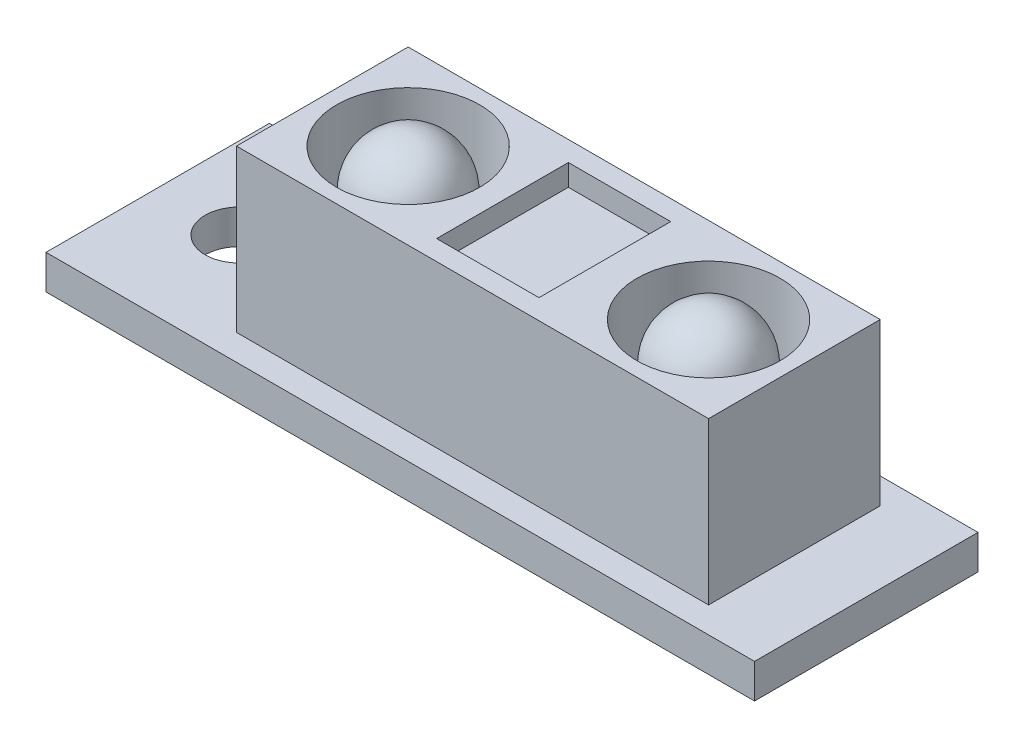
from build123d import *

# Parameters (mm, degrees)
SKETCH1_W                  = 33.02
SKETCH1_H                  = 10.414
BOSS_EXTRUDE1_DEPTH        = 1.6
SKETCH2_R                  = 1.6
CUT_EXTRUDE1_DEPTH         = 18.385423463
SKETCH3_W                  = 22
SKETCH3_H                  = 8
BOSS_EXTRUDE2_DEPTH        = 7.52
SKETCH5_R                  = 3.335
CUT_EXTRUDE2_DEPTH         = 5
SKETCH6_R                  = 2.334999968
BOSS_EXTRUDE3_DEPTH        = 3
DOME1_FACE_RADIUS          = 2.334999968
DOME1_HEIGHT               = 2.54
MIRROR1_COPY_1_FACE_RADIUS = 2.334999968
MIRROR1_COPY_1_HEIGHT      = 2.54
SKETCH7_W                  = 4.77
SKETCH7_H                  = 6.139999912
CUT_EXTRUDE3_DEPTH         = 1


with BuildPart() as part:
    # Sketch1 → Boss-Extrude1 (new body)
    with BuildSketch(Plane(origin=(0, 0, 0), x_dir=(1, 0, 0), z_dir=(0, 1, 0))):
        Rectangle(SKETCH1_W, SKETCH1_H)
    extrude(amount=BOSS_EXTRUDE1_DEPTH)

    # Sketch2 → Cut-Extrude1 (cut, through all)
    with BuildSketch(Plane(origin=(0, 1.6, 0), x_dir=(1, 0, 0), z_dir=(0, 1, 0))):
        with Locations(Location((-12.7, 0, 0), (0, 0, 270))):
            Circle(SKETCH2_R)
    extrude(amount=-CUT_EXTRUDE1_DEPTH, mode=Mode.SUBTRACT)

    # Sketch3 → Boss-Extrude2 (add)
    with BuildSketch(Plane(origin=(0, 1.6, 0), x_dir=(1, 0, 0), z_dir=(0, 1, 0))):
        with Locations((2.16, 0)):
            Rectangle(SKETCH3_W, SKETCH3_H)
    extrude(amount=BOSS_EXTRUDE2_DEPTH)

    # Sketch5 → Cut-Extrude2 (cut)
    with BuildSketch(Plane(origin=(0, 9.12, 0), x_dir=(1, 0, 0), z_dir=(0, 1, 0))):
        with Locations(Location((-4.84, 0, 0), (0, 0, 270))):
            Circle(SKETCH5_R)
        with Locations(Location((9.16, 0, 0), (0, 0, 90))):
            Circle(SKETCH5_R)
    extrude(amount=-CUT_EXTRUDE2_DEPTH, mode=Mode.SUBTRACT)

    # Sketch6 → Boss-Extrude3 (add)
    with BuildSketch(Plane(origin=(0, 4.12, 0), x_dir=(1, 0, 0), z_dir=(0, 1, 0))):
        with Locations(Location((-4.84, 0, 0), (0, 0, 270))):
            Circle(SKETCH6_R)
    boss_extrude3 = extrude(amount=BOSS_EXTRUDE3_DEPTH)

    # Dome1: a dome of height H over a round flat face of radius A is a cap of a sphere of radius (A * A + H * H) / (2 * H)
    dome1_r = (DOME1_FACE_RADIUS * DOME1_FACE_RADIUS + DOME1_HEIGHT * DOME1_HEIGHT) / (2 * DOME1_HEIGHT)
    dome1_base = Plane((-4.84, 7.12, 0), z_dir=(0, 1, 0))
    with Locations(dome1_base.offset(DOME1_HEIGHT - dome1_r)):
        dome1_ball = Sphere(dome1_r, mode=Mode.PRIVATE)
    add(split(dome1_ball, bisect_by=dome1_base, keep=Keep.TOP, mode=Mode.PRIVATE))

    # Mirror1: Boss-Extrude3 across plane
    add(boss_extrude3.mirror(Plane(origin=(2.16, 0, 0), x_dir=(0, 0, 1), z_dir=(1, 0, 0))))

    # Mirror1 copy 1: a dome of height H over a round flat face of radius A is a cap of a sphere of radius (A * A + H * H) / (2 * H)
    mirror1_copy_1_r = (MIRROR1_COPY_1_FACE_RADIUS * MIRROR1_COPY_1_FACE_RADIUS + MIRROR1_COPY_1_HEIGHT * MIRROR1_COPY_1_HEIGHT) / (2 * MIRROR1_COPY_1_HEIGHT)
    mirror1_copy_1_base = Plane((9.16, 7.12, 0), z_dir=(0, 1, 0))
    with Locations(mirror1_copy_1_base.offset(MIRROR1_COPY_1_HEIGHT - mirror1_copy_1_r)):
        mirror1_copy_1_ball = Sphere(mirror1_copy_1_r, mode=Mode.PRIVATE)
    add(split(mirror1_copy_1_ball, bisect_by=mirror1_copy_1_base, keep=Keep.TOP, mode=Mode.PRIVATE))

    # Sketch7 → Cut-Extrude3 (cut)
    with BuildSketch(Plane(origin=(0, 9.12, 0), x_dir=(1, 0, 0), z_dir=(0, 1, 0))):
        with Locations((1.942220891, 0)):
            Rectangle(SKETCH7_W, SKETCH7_H)
    extrude(amount=-CUT_EXTRUDE3_DEPTH, mode=Mode.SUBTRACT)


solid = part.part
